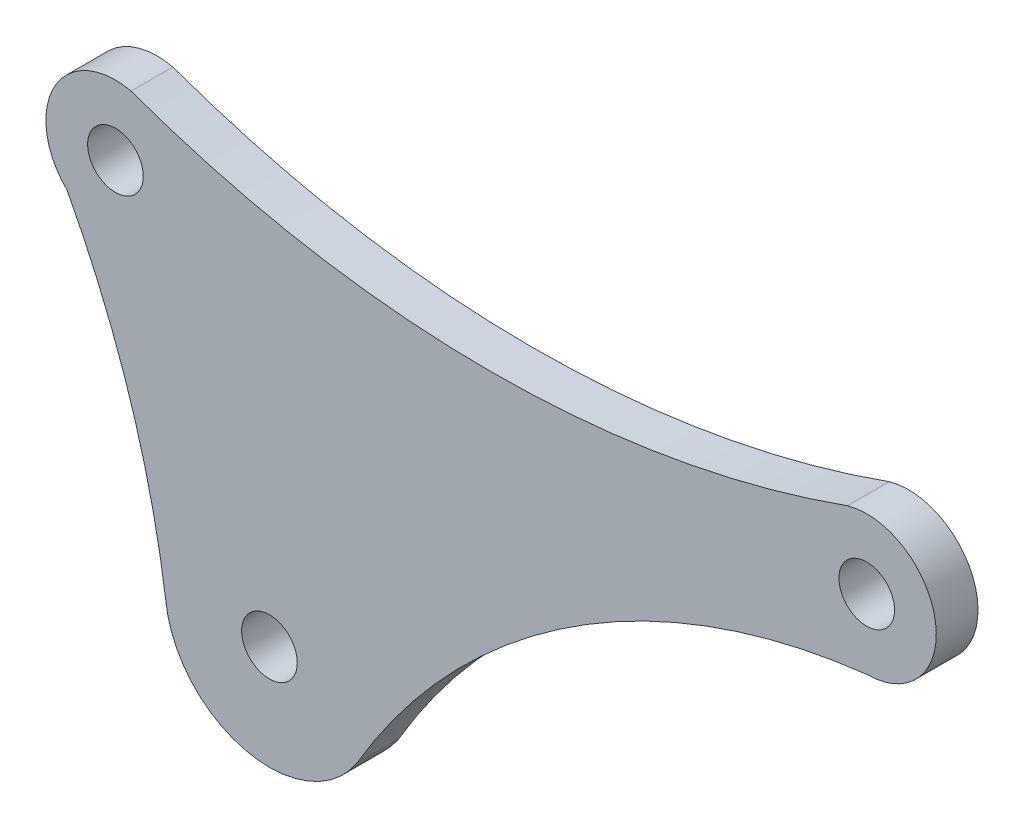
from build123d import *

# Parameters (mm, degrees)
SKETCH_1_R      = 2
EXTRUDE_1_DEPTH = 1.5


with BuildPart() as part:
    # 草图1 → 凸台-拉伸1 (new, symmetric)
    with BuildSketch(Plane.XY):
        with BuildLine():
            ThreePointArc((52.051282327, 4.604617186), (27.130077256, 0.338946041), (2.190311245, 4.494723201))
            ThreePointArc((2.190311245, 4.494723201), (1.655516013, 4.681596435), (1.122130296, 4.872455603))
            ThreePointArc((1.122130296, 4.872455603), (-4.395154703, 2.383823638), (-3.472004537, -3.597941702))
            ThreePointArc((-3.472004537, -3.597941702), (1.030595655, -14.252623677), (3.610487783, -25.528252843))
            ThreePointArc((3.610487783, -25.528252843), (9.300815316, -32.038345872), (17.342543053, -28.861593809))
            ThreePointArc((17.342543053, -28.861593809), (17.509155318, -28.5792742), (17.677657577, -28.298078543))
            ThreePointArc((17.677657577, -28.298078543), (33.128101274, -12.422940849), (54, -5))
            ThreePointArc((54, -5), (58.950668102, 0.700632103), (52.612561199, 4.803645863))
            ThreePointArc((52.612561199, 4.803645863), (52.332116942, 4.703581101), (52.051282327, 4.604617186))
        make_face()
        with Locations((11.07, -24.75)):
            Circle(SKETCH_1_R, mode=Mode.SUBTRACT)
        Circle(SKETCH_1_R, mode=Mode.SUBTRACT)
        with Locations((54, 0)):
            Circle(SKETCH_1_R, mode=Mode.SUBTRACT)
    extrude(amount=EXTRUDE_1_DEPTH, both=True)


solid = part.part
